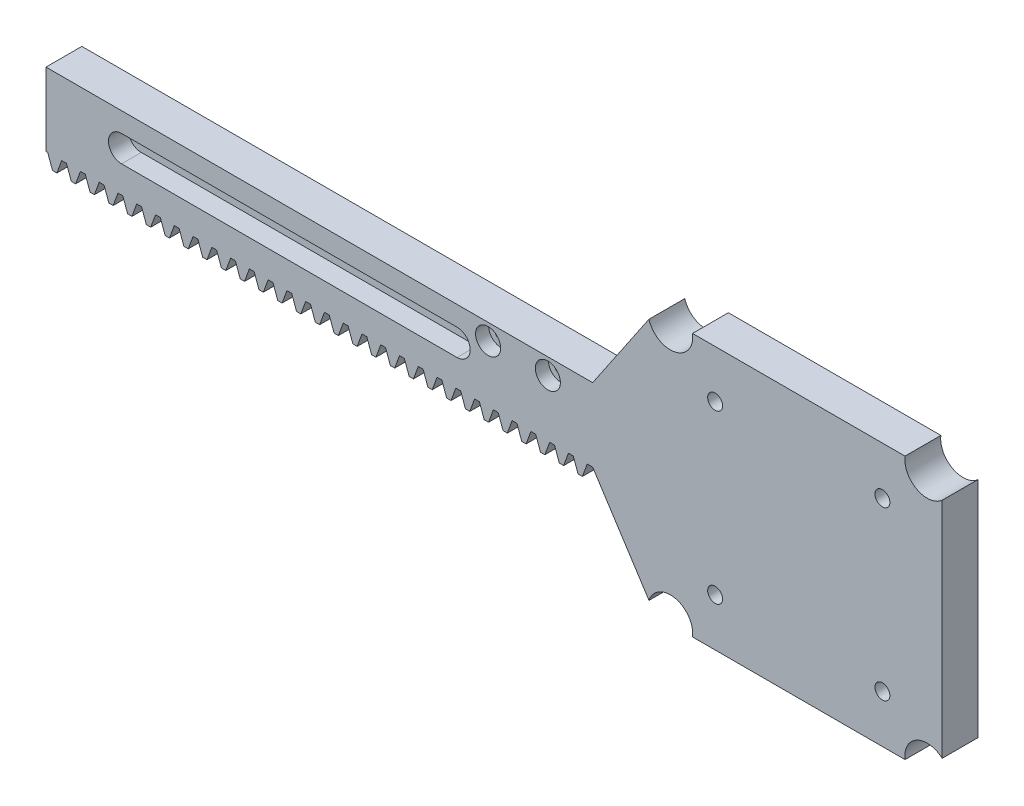
from build123d import *

# Parameters (mm, degrees)
M1_START                                       = 40.4
M1_RACK_WITH_INTEGRAL_48_X_44_MM_SEAT_FL_DEPTH = 6
F_56_55_START                                  = 43.1
F_56_55_MM_STOP_SLOT_DEPTH                     = 3.4
FOUR_START                                     = 40.3
FOUR_M3_SEAT_PILOTS_28_X_28_PITCH_PROF_R       = 1.25
FOUR_M3_SEAT_PILOTS_28_X_28_PITCH_DEPTH        = 6.2
SLIDE_START                                    = 40.3
SLIDE_FASTENER_BORES_PROFILE_R                 = 1.1
SLIDE_FASTENER_BORES_DEPTH                     = 6.2
SLIDE_START_2                                  = 44.2
SLIDE_SCREW_RECESSES_PROFILE_R                 = 2.1
SLIDE_SCREW_RECESSES_DEPTH                     = 2.3
RADAR_START                                    = 40.3
RADAR_MOUNTING_SCREW_TOOL_ACCESS_PROFILE_R     = 3.75
RADAR_MOUNTING_SCREW_TOOL_ACCESS_DEPTH         = 6.2


with BuildPart() as part:
    # M1 rack with integral 48 x 44 mm sea 2 → M1 rack with integral 48 x 44 mm seat fl (new body)
    with BuildSketch(Plane.XY.offset(M1_START)):
        Polygon((-69, 10.26), (-68.713242711, 10.26), (-67.908868493, 8.05), (-67.179615611, 8.05), (-66.375241394, 10.26), (-65.571650057, 10.26), (-64.767275839, 8.05), (-64.038022958, 8.05), (-63.23364874, 10.26), (-62.430057404, 10.26), (-61.625683186, 8.05), (-60.896430304, 8.05), (-60.092056086, 10.26), (-59.28846475, 10.26), (-58.484090532, 8.05), (-57.754837651, 8.05), (-56.950463433, 10.26), (-56.146872096, 10.26), (-55.342497879, 8.05), (-54.613244997, 8.05), (-53.808870779, 10.26), (-53.005279443, 10.26), (-52.200905225, 8.05), (-51.471652343, 8.05), (-50.667278126, 10.26), (-49.863686789, 10.26), (-49.059312572, 8.05), (-48.33005969, 8.05), (-47.525685472, 10.26), (-46.722094136, 10.26), (-45.917719918, 8.05), (-45.188467036, 8.05), (-44.384092819, 10.26), (-43.580501482, 10.26), (-42.776127264, 8.05), (-42.046874383, 8.05), (-41.242500165, 10.26), (-40.438908828, 10.26), (-39.634534611, 8.05), (-38.905281729, 8.05), (-38.100907511, 10.26), (-37.297316175, 10.26), (-36.492941957, 8.05), (-35.763689075, 8.05), (-34.959314858, 10.26), (-34.155723521, 10.26), (-33.351349304, 8.05), (-32.622096422, 8.05), (-31.817722204, 10.26), (-31.014130868, 10.26), (-30.20975665, 8.05), (-29.480503768, 8.05), (-28.676129551, 10.26), (-27.872538214, 10.26), (-27.068163996, 8.05), (-26.338911115, 8.05), (-25.534536897, 10.26), (-24.730945561, 10.26), (-23.926571343, 8.05), (-23.197318461, 8.05), (-22.392944243, 10.26), (-21.589352907, 10.26), (-20.784978689, 8.05), (-20.055725808, 8.05), (-19.25135159, 10.26), (-18.447760253, 10.26), (-17.643386036, 8.05), (-16.914133154, 8.05), (-16.109758936, 10.26), (-15.3061676, 10.26), (-14.501793382, 8.05), (-13.7725405, 8.05), (-12.968166283, 10.26), (-12.164574946, 10.26), (-11.360200728, 8.05), (-10.630947847, 8.05), (-9.826573629, 10.26), (-9.022982293, 10.26), (-8.218608075, 8.05), (-7.489355193, 8.05), (-6.684980975, 10.26), (-5.881389639, 10.26), (-5.077015421, 8.05), (-4.34776254, 8.05), (-3.543388322, 10.26), (-2.739796985, 10.26), (-1.935422768, 8.05), (-1.206169886, 8.05), (-0.401795668, 10.26), (0.401795668, 10.26), (1.206169886, 8.05), (1.935422768, 8.05), (2.739796985, 10.26), (3.543388322, 10.26), (4.34776254, 8.05), (5.077015421, 8.05), (5.881389639, 10.26), (6.684980975, 10.26), (7.489355193, 8.05), (8.218608075, 8.05), (9.022982293, 10.26), (9.826573629, 10.26), (10.630947847, 8.05), (11.360200728, 8.05), (12.164574946, 10.26), (12.968166283, 10.26), (13.7725405, 8.05), (14.501793382, 8.05), (15.3061676, 10.26), (16.109758936, 10.26), (16.914133154, 8.05), (17.643386036, 8.05), (18.447760253, 10.26), (19.25135159, 10.26), (20.055725808, 8.05), (20.784978689, 8.05), (21.589352907, 10.26), (22.5, 10.26), (33, -6), (79, -6), (81, -4), (81, 36), (79, 38), (33, 38), (22.5, 22.5), (-69, 22.5), align=None)
    extrude(amount=M1_RACK_WITH_INTEGRAL_48_X_44_MM_SEAT_FL_DEPTH)

    # 56.55 mm stop slot profile → 56.55 mm stop slot (cut)
    with BuildSketch(Plane.XY.offset(F_56_55_START)):
        with BuildLine():
            Line((-56.348667765, 14.8), (-0.2, 14.8))
            ThreePointArc((-0.2, 14.8), (2, 17), (-0.2, 19.2))
            Line((-0.2, 19.2), (-56.348667765, 19.2))
            ThreePointArc((-56.348667765, 19.2), (-58.548667765, 17), (-56.348667765, 14.8))
        make_face()
    extrude(amount=F_56_55_MM_STOP_SLOT_DEPTH, mode=Mode.SUBTRACT)

    # Four M3 seat pilots - 28 x 28 pitch profile → Four M3 seat pilots - 28 x 28 pitch (cut)
    with BuildSketch(Plane.XY.offset(FOUR_START)):
        with Locations(Location((43, 2, 0), (0, 0, 180))):
            Circle(FOUR_M3_SEAT_PILOTS_28_X_28_PITCH_PROF_R)
        with Locations(Location((43, 30, 0), (0, 0, 180))):
            Circle(FOUR_M3_SEAT_PILOTS_28_X_28_PITCH_PROF_R)
        with Locations(Location((71, 2, 0), (0, 0, 180))):
            Circle(FOUR_M3_SEAT_PILOTS_28_X_28_PITCH_PROF_R)
        with Locations(Location((71, 30, 0), (0, 0, 180))):
            Circle(FOUR_M3_SEAT_PILOTS_28_X_28_PITCH_PROF_R)
    extrude(amount=FOUR_M3_SEAT_PILOTS_28_X_28_PITCH_DEPTH, mode=Mode.SUBTRACT)

    # Slide fastener bores profile → Slide fastener bores (cut)
    with BuildSketch(Plane.XY.offset(SLIDE_START)):
        with Locations(Location((5, 19.8, 0), (0, 0, 180))):
            Circle(SLIDE_FASTENER_BORES_PROFILE_R)
        with Locations(Location((15, 19.8, 0), (0, 0, 180))):
            Circle(SLIDE_FASTENER_BORES_PROFILE_R)
    extrude(amount=SLIDE_FASTENER_BORES_DEPTH, mode=Mode.SUBTRACT)

    # Slide screw recesses profile → Slide screw recesses (cut)
    with BuildSketch(Plane.XY.offset(SLIDE_START_2)):
        with Locations((5, 19.8)):
            Circle(SLIDE_SCREW_RECESSES_PROFILE_R)
        with Locations((15, 19.8)):
            Circle(SLIDE_SCREW_RECESSES_PROFILE_R)
    extrude(amount=SLIDE_SCREW_RECESSES_DEPTH, mode=Mode.SUBTRACT)

    # Radar mounting screw tool access profile → Radar mounting screw tool access (cut)
    with BuildSketch(Plane.XY.offset(RADAR_START)):
        with Locations((35.5, -5.5)):
            Circle(RADAR_MOUNTING_SCREW_TOOL_ACCESS_PROFILE_R)
        with Locations((35.5, 37.5)):
            Circle(RADAR_MOUNTING_SCREW_TOOL_ACCESS_PROFILE_R)
        with Locations((78.5, -5.5)):
            Circle(RADAR_MOUNTING_SCREW_TOOL_ACCESS_PROFILE_R)
        with Locations((78.5, 37.5)):
            Circle(RADAR_MOUNTING_SCREW_TOOL_ACCESS_PROFILE_R)
    extrude(amount=RADAR_MOUNTING_SCREW_TOOL_ACCESS_DEPTH, mode=Mode.SUBTRACT)


solid = part.part
